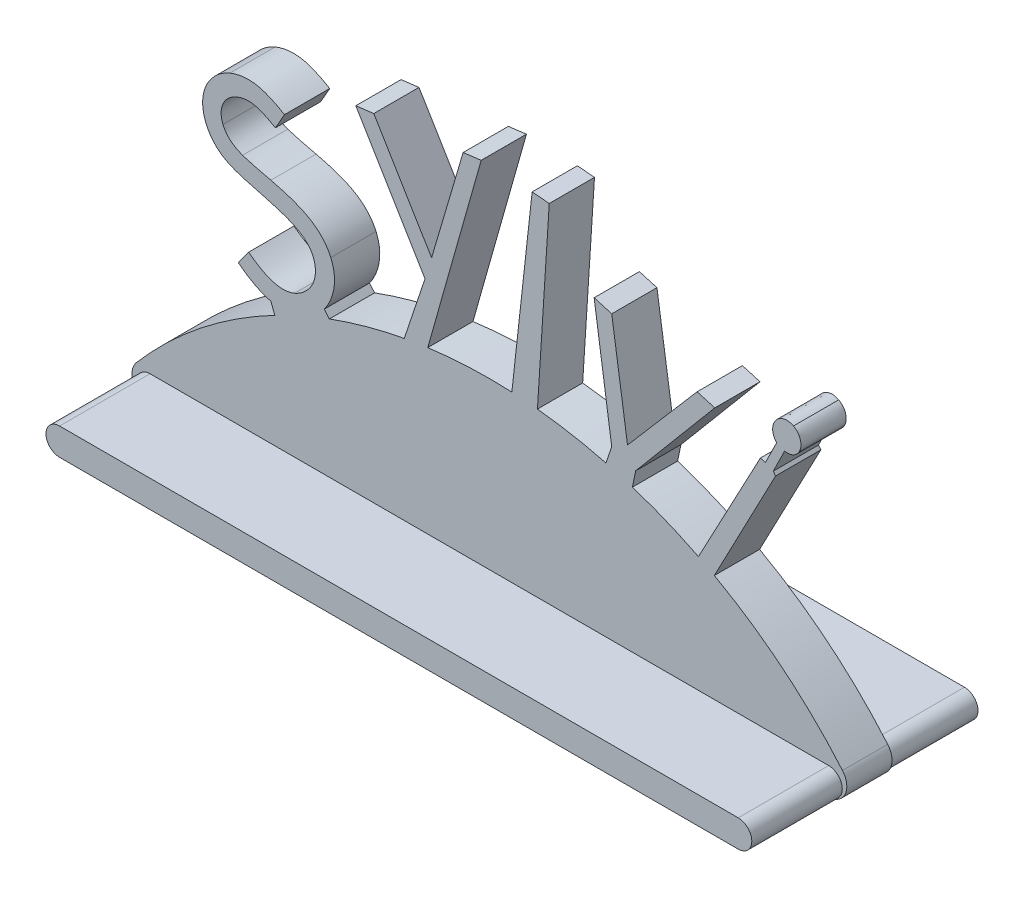
from build123d import *

# Parameters (mm, degrees)
BOSS_EXTRUDE2_DEPTH = 5
BOSS_EXTRUDE3_DEPTH = 10
BOSS_EXTRUDE4_START = -15
BOSS_EXTRUDE4_DEPTH = 15


with BuildPart() as part:
    # Sketch1 → Boss-Extrude2 (new body)
    with BuildSketch(Plane.XY):
        with BuildLine():
            Line((-78.741568111, -19.971768976), (-3.741568111, -19.971768976))
            ThreePointArc((-3.741568111, -19.971768976), (-1.925462789, -18.809481014), (-2.22019482, -16.673530435))
            ThreePointArc((-2.22019482, -16.673530435), (-8.780370535, -10.251359671), (-16.380218592, -5.101360425))
            Line((-16.380218592, -5.101360425), (-9.612691202, 7.806260007))
            Line((-9.612691202, 7.806260007), (-9.86583371, 8.144857173))
            Line((-9.86583371, 8.144857173), (-8.61248496, 10.691935164))
            ThreePointArc((-8.61248496, 10.691935164), (-7.666070715, 10.805724394), (-6.984486074, 11.472125392))
            add(Edge.make_bspline(
                [(-7.633524535, 13.583503597), (-7.450761524, 13.489644152), (-7.213840291, 13.290979351), (-6.978980446, 12.951993331), (-6.869514847, 12.661121381), (-6.802239701, 12.358467844), (-6.796442313, 11.948035815), (-6.886666268, 11.651001568), (-6.984486074, 11.472125392)],
                knots=[0, 0, 0, 0, 0.250093518, 0.372591704, 0.501081381, 0.628126013, 0.750820633, 1, 1, 1, 1], degree=3))
            add(Edge.make_bspline(
                [(-9.73288351, 12.930458725), (-9.642833996, 13.114689808), (-9.443689396, 13.350838456), (-9.106278637, 13.58372579), (-8.816316539, 13.696492608), (-8.514379617, 13.759128454), (-8.105420981, 13.777183759), (-7.812905809, 13.671949699), (-7.633524535, 13.583503597)],
                knots=[0, 0, 0, 0, 0.250257596, 0.373276475, 0.500787074, 0.629979667, 0.751586518, 1, 1, 1, 1], degree=3))
            ThreePointArc((-9.73288351, 12.930458725), (-9.923935025, 11.945750853), (-9.501884753, 11.035792699))
            Line((-9.501884753, 11.035792699), (-10.743063447, 8.513446916))
            Line((-10.743063447, 8.513446916), (-11.287370689, 8.695683084))
            Line((-11.287370689, 8.695683084), (-18.138332228, -4.171324053))
            ThreePointArc((-18.138332228, -4.171324053), (-21.727898204, -2.530679716), (-25.432974513, -1.170860871))
            Line((-25.432974513, -1.170860871), (-25.069395331, 0.580046463))
            Line((-25.069395331, 0.580046463), (-16.330585564, 10.968718496))
            Line((-16.330585564, 10.968718496), (-18.281707358, 11.537628752))
            Line((-18.281707358, 11.537628752), (-25.974015051, 2.587308239))
            Line((-25.974015051, 2.587308239), (-27.720809923, 14.278013368))
            Line((-27.720809923, 14.278013368), (-29.663918897, 14.842917214))
            Line((-29.663918897, 14.842917214), (-27.720809923, 1.554312301))
            Line((-27.720809923, 1.554312301), (-28.359879691, -0.317943676))
            ThreePointArc((-28.359879691, -0.317943676), (-32.120422045, 0.508375218), (-35.932349286, 1.050309175))
            Line((-35.932349286, 1.050309175), (-34.624377569, 21.384965247))
            Line((-34.624377569, 21.384965247), (-36.51540321, 21.549228068))
            Line((-36.51540321, 21.549228068), (-38.75734238, 1.265608845))
            ThreePointArc((-38.75734238, 1.265608845), (-43.415294998, 1.279720513), (-48.055324827, 0.871253975))
            Line((-48.055324827, 0.871253975), (-42.147593657, 21.753859749))
            Line((-42.147593657, 21.753859749), (-44.142785965, 21.505462313))
            Line((-44.142785965, 21.505462313), (-47.628362888, 9.682545647))
            Line((-47.628362888, 9.682545647), (-54.018587247, 20.295526416))
            Line((-54.018587247, 20.295526416), (-56.001760324, 20.05113539))
            Line((-56.001760324, 20.05113539), (-48.357529555, 7.310750775))
            Line((-48.357529555, 7.310750775), (-50.64879376, 0.455846167))
            ThreePointArc((-50.64879376, 0.455846167), (-54.83620271, -0.508386828), (-58.928221607, -1.819691643))
            Line((-58.928221607, -1.819691643), (-59.486067441, -1.158027443))
            add(Edge.make_bspline(
                [(-58.767965197, 4.138446916), (-58.632433324, 3.816801767), (-58.468358871, 3.319082371), (-58.366098618, 2.634631673), (-58.3466812, 2.121545012), (-58.379417146, 1.606246847), (-58.463270637, 1.086393233), (-58.606482046, 0.56416884), (-58.796807034, 0.043574067), (-59.033719801, -0.460344067), (-59.271505549, -0.858346777), (-59.430431513, -1.083264481), (-59.486067441, -1.158027443)],
                knots=[0, 0, 0, 0, 0.121781099, 0.181574349, 0.240755291, 0.300472346, 0.361329437, 0.424016921, 0.488980365, 0.554382868, 0.617867681, 0.650348779, 0.650348779, 0.650348779, 0.650348779], degree=3))
            add(Edge.make_bspline(
                [(-65.390561351, 8.228991788), (-64.902633685, 8.11335842), (-64.197343772, 7.930027482), (-63.30082814, 7.648617805), (-62.702754479, 7.437735793), (-62.157486852, 7.215304215), (-61.659011579, 6.995874871), (-61.216291722, 6.757066667), (-60.820416283, 6.511804438), (-60.464236381, 6.256055058), (-60.137081831, 5.991954452), (-59.842095933, 5.711084522), (-59.57177985, 5.420831504), (-59.325849876, 5.122216348), (-59.042997791, 4.702475861), (-58.866736697, 4.368795154), (-58.767965197, 4.138446916)],
                knots=[0, 0, 0, 0, 0.186086103, 0.270248898, 0.348617432, 0.421314367, 0.488737906, 0.550594007, 0.607796965, 0.661428342, 0.713205301, 0.763683035, 0.812420785, 0.860327651, 0.907059076, 1, 1, 1, 1], degree=3))
            add(Edge.make_bspline(
                [(-68.523574172, 9.04629948), (-68.396612088, 8.99692969), (-68.167885624, 8.932674132), (-67.822681295, 8.829587353), (-67.462472448, 8.741924709), (-67.040068418, 8.624950832), (-66.339508944, 8.460880027), (-65.784421087, 8.318818486), (-65.390561351, 8.228991788)],
                knots=[0, 0, 0, 0, 0.12599631, 0.2199558, 0.333661203, 0.469275345, 0.625880467, 1, 1, 1, 1], degree=3))
            add(Edge.make_bspline(
                [(-70.6830293, 10.92129948), (-70.601306913, 10.722659524), (-70.440559075, 10.442911586), (-70.176671502, 10.102032106), (-69.945492523, 9.861294672), (-69.667807749, 9.638744932), (-69.201334848, 9.344430186), (-68.807975318, 9.157833741), (-68.523574172, 9.04629948)],
                knots=[0, 0, 0, 0, 0.218443146, 0.327061405, 0.438706758, 0.557731006, 0.688726341, 1, 1, 1, 1], degree=3))
            add(Edge.make_bspline(
                [(-69.172612633, 14.306716147), (-69.511756213, 14.161655375), (-69.983847692, 13.873046286), (-70.45405743, 13.327830865), (-70.699757947, 12.872538265), (-70.860109839, 12.390898657), (-70.924691342, 11.722815348), (-70.816815176, 11.227449341), (-70.6830293, 10.92129948)],
                knots=[0, 0, 0, 0, 0.267898881, 0.392815055, 0.517554903, 0.640589918, 0.758266987, 1, 1, 1, 1], degree=3))
            add(Edge.make_bspline(
                [(-64.881747248, 13.497421275), (-65.131263273, 13.64260309), (-65.498488971, 13.841975967), (-65.981952248, 14.076627748), (-66.309705416, 14.220091407), (-66.613283696, 14.342317276), (-66.89590463, 14.435001247), (-67.156590592, 14.504476031), (-67.474050637, 14.563066674), (-67.855706706, 14.588482312), (-68.458151623, 14.553614157), (-68.894847855, 14.422927167), (-69.172612633, 14.306716147)],
                knots=[0, 0, 0, 0, 0.190224357, 0.275245305, 0.354059146, 0.425966528, 0.490811339, 0.549939734, 0.603623768, 0.703320152, 0.801201549, 1, 1, 1, 1], degree=3))
            Line((-64.881747248, 13.497421275), (-63.880144684, 15.260241788))
            add(Edge.make_bspline(
                [(-69.933830582, 16.205754609), (-69.513295772, 16.381090891), (-68.853238941, 16.577215714), (-67.941877747, 16.644437502), (-67.365333828, 16.616381664), (-66.892164866, 16.540200621), (-66.513767424, 16.457091758), (-66.118342421, 16.335118276), (-65.706198306, 16.181361955), (-65.273412125, 16.000433275), (-64.656516975, 15.701803067), (-64.189303477, 15.45072506), (-63.880144684, 15.260241788)],
                knots=[0, 0, 0, 0, 0.214161728, 0.319803879, 0.427786477, 0.484270987, 0.544656863, 0.60951191, 0.678342132, 0.751116739, 0.829635576, 1, 1, 1, 1], degree=3))
            add(Edge.make_bspline(
                [(-72.537997248, 10.039889224), (-72.699924208, 10.423103558), (-72.879352145, 11.021532774), (-72.94502161, 11.843768949), (-72.907239666, 12.454016596), (-72.793405814, 13.053087924), (-72.594265674, 13.630883408), (-72.311141631, 14.176924469), (-71.952867114, 14.690179975), (-71.530731024, 15.160157094), (-70.887413064, 15.719513247), (-70.325012877, 16.03360424), (-69.933830582, 16.205754609)],
                knots=[0, 0, 0, 0, 0.167259885, 0.248534251, 0.330232567, 0.412205276, 0.492803826, 0.574873056, 0.658521405, 0.743628325, 0.828073057, 1, 1, 1, 1], degree=3))
            add(Edge.make_bspline(
                [(-70.37854212, 7.668094352), (-70.627652518, 7.805639689), (-70.9722993, 8.047615887), (-71.399985718, 8.403057985), (-71.682302292, 8.693044319), (-71.942916405, 8.998542942), (-72.245594257, 9.438611346), (-72.43504668, 9.792904819), (-72.537997248, 10.039889224)],
                knots=[0, 0, 0, 0, 0.260807588, 0.386135149, 0.510165507, 0.632036097, 0.754528526, 1, 1, 1, 1], degree=3))
            add(Edge.make_bspline(
                [(-66.480304941, 6.38604307), (-66.939237906, 6.502621912), (-67.595956056, 6.667446498), (-68.419611416, 6.911189468), (-68.940765479, 7.074778748), (-69.395808469, 7.228832255), (-69.874725426, 7.411038295), (-70.193103717, 7.56107394), (-70.37854212, 7.668094352)],
                knots=[0, 0, 0, 0, 0.345397229, 0.493639797, 0.626407156, 0.743760431, 0.843968387, 1, 1, 1, 1], degree=3))
            add(Edge.make_bspline(
                [(-62.105304941, 4.791491788), (-62.356866575, 4.951538017), (-62.777303601, 5.161854383), (-63.380042704, 5.420444816), (-63.900857916, 5.626853211), (-64.474365291, 5.820311723), (-65.336019546, 6.085947908), (-66.011131019, 6.270883703), (-66.480304941, 6.38604307)],
                knots=[0, 0, 0, 0, 0.191129549, 0.301354285, 0.4210936, 0.550707456, 0.689838971, 1, 1, 1, 1], degree=3))
            add(Edge.make_bspline(
                [(-60.723093402, 3.25703666), (-60.851189896, 3.567707672), (-61.245067162, 4.156191539), (-61.794348708, 4.60151737), (-62.105304941, 4.791491788)],
                knots=[0, 0, 0, 0, 0.478763352, 1, 1, 1, 1], degree=3))
            add(Edge.make_bspline(
                [(-62.770369043, -1.27821975), (-62.47015786, -1.150382314), (-62.045621951, -0.905532807), (-61.55143172, -0.482487254), (-61.226177582, -0.123343882), (-60.944629691, 0.265492393), (-60.727723589, 0.680265998), (-60.571827919, 1.1099382), (-60.485181701, 1.551864915), (-60.457404072, 1.993689795), (-60.494603127, 2.573244111), (-60.607185359, 2.993418071), (-60.723093402, 3.25703666)],
                knots=[0, 0, 0, 0, 0.17681794, 0.263605663, 0.351769034, 0.438975638, 0.523187664, 0.604726612, 0.685956309, 0.76649236, 0.844137921, 1, 1, 1, 1], degree=3))
            add(Edge.make_bspline(
                [(-67.838478018, 0.124023839), (-67.392620144, -0.230053647), (-66.719474789, -0.701304364), (-65.779343867, -1.163340947), (-65.129649786, -1.391168667), (-64.503683962, -1.526160956), (-63.704505047, -1.561737642), (-63.125855253, -1.426143664), (-62.770369043, -1.27821975)],
                knots=[0, 0, 0, 0, 0.309539508, 0.444191955, 0.567856449, 0.682675732, 0.790858412, 1, 1, 1, 1], degree=3))
            Line((-67.838478018, 0.124023839), (-68.988317761, -1.466521032))
            add(Edge.make_bspline(
                [(-65.390561351, -3.342907153), (-65.483303049, -3.323660067), (-65.728151046, -3.26580389), (-66.122211697, -3.139838517), (-66.579947428, -2.963507959), (-67.042690206, -2.739351416), (-67.521754448, -2.485264921), (-68.181550366, -2.069924123), (-68.670512859, -1.723841573), (-68.988317761, -1.466521032)],
                knots=[0.469780366, 0.469780366, 0.469780366, 0.469780366, 0.506586919, 0.567505617, 0.630460862, 0.697109486, 0.767257296, 0.84116393, 1, 1, 1, 1], degree=3))
            Line((-65.390561351, -3.342907153), (-64.958282523, -4.485972062))
            ThreePointArc((-64.958282523, -4.485972062), (-73.19702237, -9.843360006), (-80.262941402, -16.673530435))
            ThreePointArc((-80.262941402, -16.673530435), (-80.557673433, -18.809481014), (-78.741568111, -19.971768976))
        make_face()
    extrude(amount=BOSS_EXTRUDE2_DEPTH)

    # Sketch3 → Boss-Extrude3 (add)
    with BuildSketch(Plane.XY.offset(5)):
        with BuildLine():
            Line((-78.741568111, -19.971768976), (-3.741568111, -19.971768976))
            ThreePointArc((-3.741568111, -19.971768976), (-2.241568111, -18.471768976), (-3.741568111, -16.971768976))
            Line((-3.741568111, -16.971768976), (-78.741568111, -16.971768976))
            ThreePointArc((-78.741568111, -16.971768976), (-80.241568111, -18.471768976), (-78.741568111, -19.971768976))
        make_face()
    extrude(amount=BOSS_EXTRUDE3_DEPTH)

    # Sketch3<2> → Boss-Extrude4 (add)
    with BuildSketch(Plane.XY.offset(5).offset(BOSS_EXTRUDE4_START)):
        with BuildLine():
            Line((-78.741568111, -19.971768976), (-3.741568111, -19.971768976))
            ThreePointArc((-3.741568111, -19.971768976), (-2.241568111, -18.471768976), (-3.741568111, -16.971768976))
            Line((-3.741568111, -16.971768976), (-78.741568111, -16.971768976))
            ThreePointArc((-78.741568111, -16.971768976), (-80.241568111, -18.471768976), (-78.741568111, -19.971768976))
        make_face()
    extrude(amount=BOSS_EXTRUDE4_DEPTH)


solid = part.part
